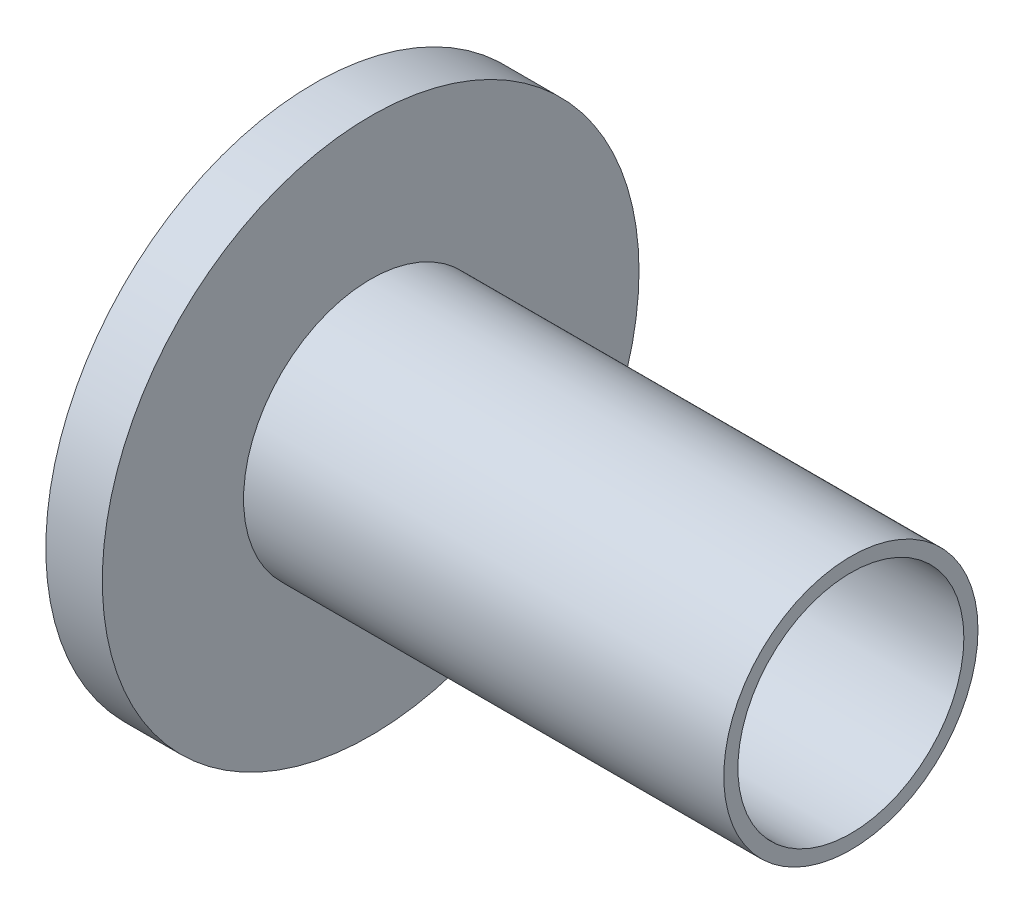
from build123d import *

# Parameters (mm, degrees)
SKETCH5_R          = 4
CUT_EXTRUDE2_DEPTH = 28.522717889


with BuildPart() as part:
    # Sketch3 → Revolve2 (revolve)
    with BuildSketch(Plane.XY, mode=Mode.PRIVATE) as revolve2_sk:
        Polygon((6, 8), (-11, 8), (-13, 8), (-13, 17.5), (-11, 17.5), (-11, 12.5), (6, 12.5), align=None)
    revolve(revolve2_sk.sketch.rotate(Axis((6, 8, 0), (-1, 0, 0)), 90), axis=Axis((6, 8, 0), (-1, 0, 0)))

    # Sketch5 → Cut-Extrude2 (cut, through all)
    with BuildSketch(Plane(origin=(6, 0, 0), x_dir=(0, 0, -1), z_dir=(1, 0, 0))):
        with Locations((0, 8)):
            Circle(SKETCH5_R)
    extrude(amount=-CUT_EXTRUDE2_DEPTH, mode=Mode.SUBTRACT)


solid = part.part
